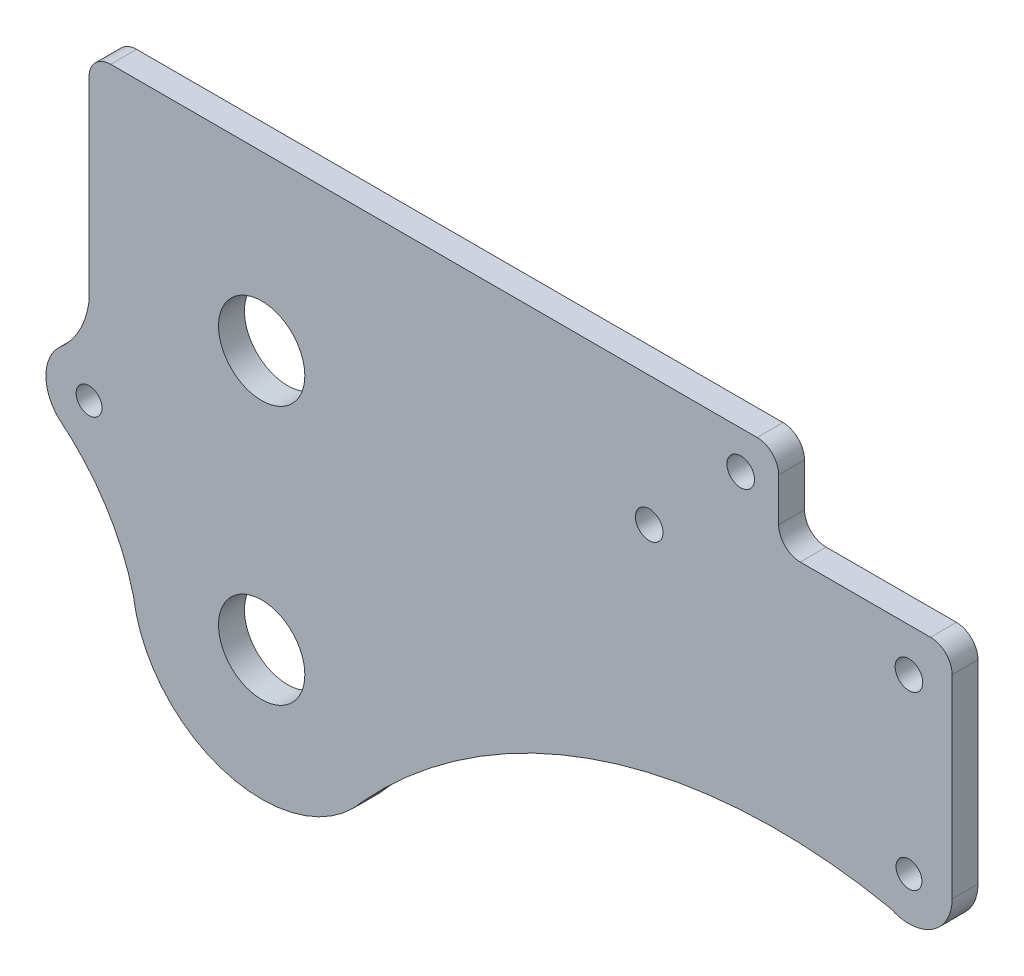
from build123d import *

# Parameters (mm, degrees)
SKETCH_1_R               = 5
SKETCH_1_R_2             = 2.15
EXTRUDE_1_DEPTH          = 3
SKETCH_2_R               = 1.5
CUT_EXTRUDE_1_DEPTH      = 117.657618697
CUT_EXTRUDE_3_DEPTH      = 117.657618697
SKETCH_5_W               = 40
SKETCH_5_H               = 20
SKETCH_5_R               = 2.15
EXTRUDE_2_DEPTH          = 3
SKETCH_6_R               = 5
CUT_EXTRUDE_4_DEPTH      = 117.657618697
SKETCH_7_R               = 1.5
EXTRUDE_4_DEPTH          = 3
CUT_EXTRUDE_6_DEPTH      = 117.657618697
CUT_EXTRUDE_6_DEPTH_BACK = 117.657618697
SKETCH_9_R               = 1.6
CUT_EXTRUDE_7_DEPTH      = 117.657618697
SKETCH_10_W              = 79.9
SKETCH_10_H              = 10
SKETCH_10_R              = 1.6
EXTRUDE_5_DEPTH          = 3
FILLET_1_R               = 2.5


with BuildPart() as part:
    # ｽｹｯﾁ1 → ﾎﾞｽ - 押し出し1 (new body)
    with BuildSketch(Plane.XY):
        Polygon((10, 60), (0, 60), (0, 0), (100, 0), (100, 50), (100, 60), (50, 60), (50, 40), (10, 40), align=None)
        with Locations((20, 20)):
            Circle(SKETCH_1_R, mode=Mode.SUBTRACT)
        with Locations((5.25, 45)):
            Circle(SKETCH_1_R_2, mode=Mode.SUBTRACT)
        with Locations((5.25, 55)):
            Circle(SKETCH_1_R_2, mode=Mode.SUBTRACT)
        with Locations((54.75, 45)):
            Circle(SKETCH_1_R_2, mode=Mode.SUBTRACT)
        with Locations((54.75, 55)):
            Circle(SKETCH_1_R_2, mode=Mode.SUBTRACT)
    extrude(amount=EXTRUDE_1_DEPTH)

    # ｽｹｯﾁ2 → ｶｯﾄ - 押し出し1 (cut, through all)
    with BuildSketch(Plane.XY.offset(3)):
        with Locations((95, 35)):
            Circle(SKETCH_2_R)
    extrude(amount=-CUT_EXTRUDE_1_DEPTH, mode=Mode.SUBTRACT)

    # ｽｹｯﾁ4 → ｶｯﾄ - 押し出し3 (cut, through all)
    with BuildSketch(Plane.XY.offset(3)):
        with BuildLine():
            ThreePointArc((30.606601718, 9.393398282), (11.666446505, 7.527955815), (6.141807012, 25.740251485))
            ThreePointArc((6.141807012, 25.740251485), (5.992593584, 34.011854082), (1.731818145, 41.103219734))
            ThreePointArc((1.731818145, 41.103219734), (1.633577382, 41.194216579), (1.537689399, 41.287689399))
            ThreePointArc((1.537689399, 41.287689399), (0.399632454, 42.99091198), (0, 45))
            Line((0, 45), (0, 0))
            Line((0, 0), (100, 0))
            Line((100, 0), (100, 35))
            ThreePointArc((100, 35), (98.535533906, 31.464466094), (95, 30))
            ThreePointArc((95, 30), (93.906844507, 30.120962075), (92.866581158, 30.477995572))
            ThreePointArc((92.866581158, 30.477995572), (59.698938801, 28.658859349), (31.76111788, 10.689999666))
            ThreePointArc((31.76111788, 10.689999666), (31.202634234, 10.024981894), (30.606601718, 9.393398282))
        make_face()
    extrude(amount=-CUT_EXTRUDE_3_DEPTH, mode=Mode.SUBTRACT)

    # ｽｹｯﾁ5 → ﾎﾞｽ - 押し出し2 (add, through all)
    with BuildSketch(Plane.XY.offset(3)):
        with Locations((30, 50)):
            Rectangle(SKETCH_5_W, SKETCH_5_H)
        with Locations((5.25, 55)):
            Circle(SKETCH_5_R)
        with Locations((5.25, 45)):
            Circle(SKETCH_5_R)
        with Locations((54.75, 45)):
            Circle(SKETCH_5_R)
        with Locations((54.75, 55)):
            Circle(SKETCH_5_R)
    extrude(amount=-EXTRUDE_2_DEPTH)

    # ｽｹｯﾁ6 → ｶｯﾄ - 押し出し4 (cut, through all)
    with BuildSketch(Plane.XY.offset(3)):
        with Locations((20, 50)):
            Circle(SKETCH_6_R)
    extrude(amount=-CUT_EXTRUDE_4_DEPTH, mode=Mode.SUBTRACT)

    # ｽｹｯﾁ7 → ﾎﾞｽ - 押し出し4 (add, through all)
    # profile 1 of 2: a face of its own
    with BuildSketch(Plane.XY.offset(3)):
        with BuildLine():
            ThreePointArc((0, 45), (-1.007160055, 41.702552665), (-3.074339462, 38.943150628))
            ThreePointArc((-3.074339462, 38.943150628), (2.194117441, 39.492866419), (5, 35))
            ThreePointArc((5, 35), (2.338239569, 30.580425844), (-2.813054288, 30.866390733))
            ThreePointArc((-2.813054288, 30.866390733), (2.156646174, 25.048507639), (5.133931253, 18))
            ThreePointArc((5.133931253, 18), (5.125569714, 21.936833416), (6.141807012, 25.740251485))
            ThreePointArc((6.141807012, 25.740251485), (5.992593584, 34.011854082), (1.731818145, 41.103219734))
            ThreePointArc((1.731818145, 41.103219734), (0.4524509, 42.867859613), (0, 45))
        make_face()
    # profile 2 of 2: a face of its own
    with BuildSketch(Plane.XY.offset(3)):
        with BuildLine():
            ThreePointArc((-3.074339462, 38.943150628), (-3.301799792, 38.735793058), (-3.535533906, 38.535533906))
            ThreePointArc((-3.535533906, 38.535533906), (-5, 35), (-3.535533906, 31.464466094))
            ThreePointArc((-3.535533906, 31.464466094), (-3.171489153, 31.168816808), (-2.813054288, 30.866390733))
            ThreePointArc((-2.813054288, 30.866390733), (2.338239569, 30.580425844), (5, 35))
            ThreePointArc((5, 35), (2.194117441, 39.492866419), (-3.074339462, 38.943150628))
        make_face()
        with Locations((0, 35)):
            Circle(SKETCH_7_R, mode=Mode.SUBTRACT)
    extrude(amount=-EXTRUDE_4_DEPTH)

    # ｽｹｯﾁ9 → ｶｯﾄ - 押し出し6 (cut, two sides: drawn at the far end of the back side and taken through both)
    with BuildSketch(Plane.XY.offset(3).offset(-CUT_EXTRUDE_6_DEPTH_BACK)):
        with Locations((64.9, 55)):
            Circle(SKETCH_9_R)
    extrude(amount=CUT_EXTRUDE_6_DEPTH + CUT_EXTRUDE_6_DEPTH_BACK, mode=Mode.SUBTRACT)

    # ｽｹｯﾁ8 → ｶｯﾄ - 押し出し7 (cut, through all)
    with BuildSketch(Plane.XY.offset(3)):
        with BuildLine():
            ThreePointArc((95, 56.6), (93.4, 55), (95, 53.4))
            Line((95, 53.4), (95, 56.6))
        make_face()
        with BuildLine():
            Line((95, 56.6), (95, 53.4))
            ThreePointArc((95, 53.4), (96.13137085, 53.86862915), (96.6, 55))
            ThreePointArc((96.6, 55), (96.13137085, 56.13137085), (95, 56.6))
        make_face()
    extrude(amount=-CUT_EXTRUDE_7_DEPTH, mode=Mode.SUBTRACT)

    # ｽｹｯﾁ10 → ﾎﾞｽ - 押し出し5 (add, through all)
    with BuildSketch(Plane.XY.offset(3)):
        with Locations((39.95, 65)):
            Rectangle(SKETCH_10_W, SKETCH_10_H)
        with Locations((75.506601718, 65.606601718)):
            Circle(SKETCH_10_R, mode=Mode.SUBTRACT)
    extrude(amount=-EXTRUDE_5_DEPTH)

    # ﾌｨﾚｯﾄ1
    fillet_1_edges = [part.edges().sort_by_distance(p)[0] for p in [
        (0, 70, 1.5),
        (79.9, 70, 1.5),
        (79.9, 60, 1.5),
        (100, 60, 1.5),
    ]]
    fillet(fillet_1_edges, radius=FILLET_1_R)


solid = part.part
